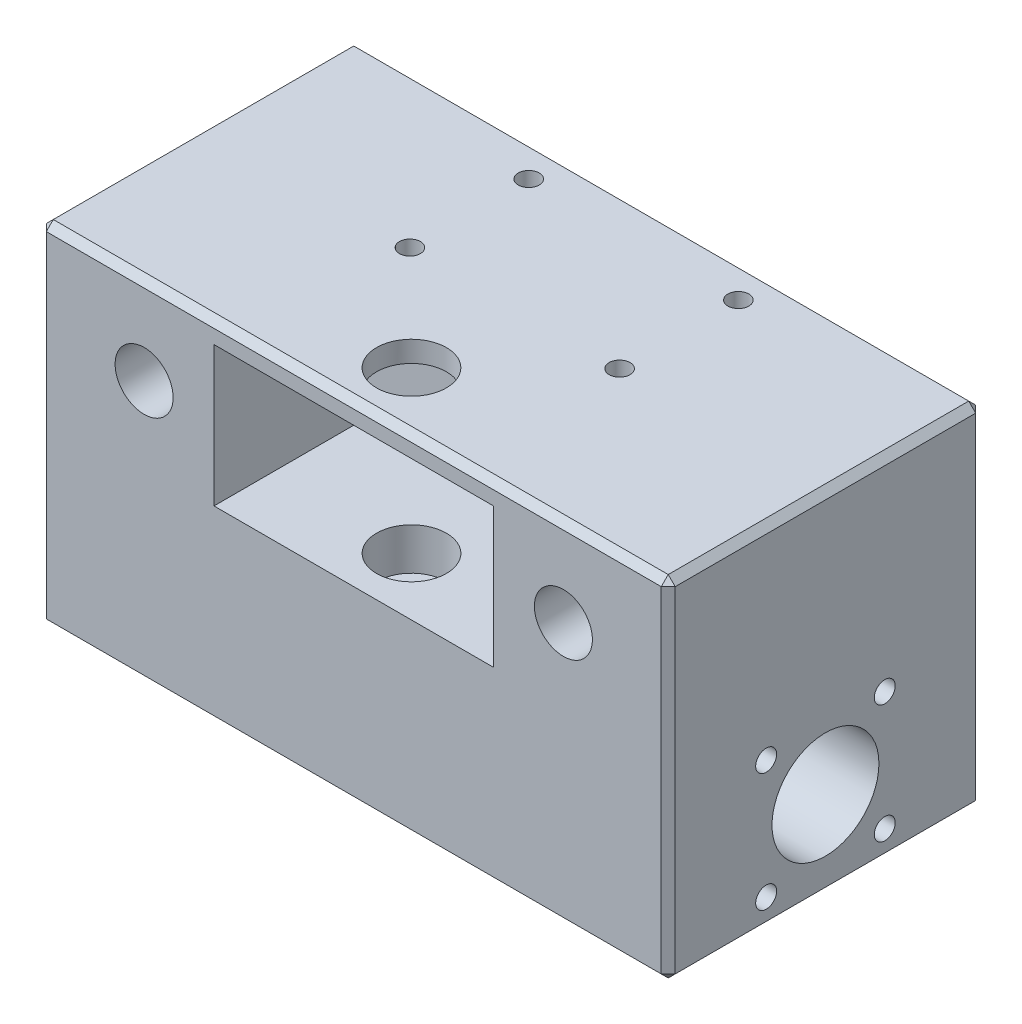
from build123d import *

# Parameters (mm, degrees)
SKETCH1_W           = 90
SKETCH1_H           = 45
BOSS_EXTRUDE1_DEPTH = 50
SKETCH2_R           = 4.15
CUT_EXTRUDE1_DEPTH  = 28.296664924
SKETCH3_R           = 7.65
CUT_EXTRUDE2_DEPTH  = 106.386194542
SKETCH4_R           = 1.5
CUT_EXTRUDE3_DEPTH  = 10
CHAMFER1_SIZE       = 1
SKETCH5_R           = 1.5
CUT_EXTRUDE4_DEPTH  = 10
SKETCH6_W           = 40
SKETCH6_H           = 20
CUT_EXTRUDE5_DEPTH  = 20
SKETCH7_R           = 5
CUT_EXTRUDE6_DEPTH  = 29


with BuildPart() as part:
    # Sketch1 → Boss-Extrude1 (new body)
    with BuildSketch(Plane(origin=(0, 0, 0), x_dir=(1, 0, 0), z_dir=(0, 1, 0))):
        Rectangle(SKETCH1_W, SKETCH1_H)
    extrude(amount=BOSS_EXTRUDE1_DEPTH)

    # Sketch2 → Cut-Extrude1 (cut)
    with BuildSketch(Plane.XY.offset(22.5)):
        with Locations((-30, 37.5)):
            Circle(SKETCH2_R)
        with Locations(Location((30, 37.5, 0), (0, 0, 180))):
            Circle(SKETCH2_R)
    extrude(amount=-CUT_EXTRUDE1_DEPTH, mode=Mode.SUBTRACT)

    # Sketch3 → Cut-Extrude2 (cut, through all)
    with BuildSketch(Plane(origin=(45, 0, 0), x_dir=(0, 0, -1), z_dir=(1, 0, 0))):
        with Locations((0, 12.5)):
            Circle(SKETCH3_R)
    extrude(amount=-CUT_EXTRUDE2_DEPTH, mode=Mode.SUBTRACT)

    # Sketch4 → Cut-Extrude3 (cut)
    with BuildSketch(Plane(origin=(45, 0, 0), x_dir=(0, 0, -1), z_dir=(1, 0, 0))):
        with Locations((-8.485281374, 20.985281374)):
            Circle(SKETCH4_R)
        with Locations((8.485281374, 20.985281374)):
            Circle(SKETCH4_R)
        with Locations((8.485281374, 4.014718626)):
            Circle(SKETCH4_R)
        with Locations((-8.485281374, 4.014718626)):
            Circle(SKETCH4_R)
    cut_extrude3 = extrude(amount=-CUT_EXTRUDE3_DEPTH, mode=Mode.SUBTRACT)

    # Mirror1: Cut-Extrude3 across plane
    add(cut_extrude3.mirror(Plane(origin=(0, 0, 0), x_dir=(0, 0, 1), z_dir=(1, 0, 0))), mode=Mode.SUBTRACT)

    # Chamfer1
    chamfer1_edges = [part.edges().sort_by_distance(p)[0] for p in [
        (-45, 50, 0),
        (0, 50, 22.5),
        (45, 50, 0),
        (0, 0, 22.5),
        (-45, 0, 0),
        (0, 0, -22.5),
        (45, 0, 0),
        (45, 25, 22.5),
        (-45, 25, 22.5),
        (-45, 25, -22.5),
        (45, 25, -22.5),
        (0, 50, -22.5),
    ]]
    chamfer(chamfer1_edges, length=CHAMFER1_SIZE)

    # Sketch5 → Cut-Extrude4 (cut)
    with BuildSketch(Plane(origin=(0, 50, 0), x_dir=(1, 0, 0), z_dir=(0, 1, 0))):
        with Locations(Location((15, 0.53825434, 0), (0, 0, 270))):
            Circle(SKETCH5_R)
        with Locations(Location((15, 17.53825434, 0), (0, 0, 270))):
            Circle(SKETCH5_R)
        with Locations(Location((-15, 17.53825434, 0), (0, 0, 90))):
            Circle(SKETCH5_R)
        with Locations(Location((-15, 0.53825434, 0), (0, 0, 90))):
            Circle(SKETCH5_R)
    extrude(amount=-CUT_EXTRUDE4_DEPTH, mode=Mode.SUBTRACT)

    # Sketch6 → Cut-Extrude5 (cut)
    with BuildSketch(Plane.XY.offset(22.5)):
        with Locations((0, 37)):
            Rectangle(SKETCH6_W, SKETCH6_H)
    extrude(amount=-CUT_EXTRUDE5_DEPTH, mode=Mode.SUBTRACT)

    # Sketch7 → Cut-Extrude6 (cut)
    with BuildSketch(Plane(origin=(0, 50, 0), x_dir=(1, 0, 0), z_dir=(0, 1, 0))):
        with Locations(Location((0, -14.241832216, 0), (0, 0, 90))):
            Circle(SKETCH7_R)
    extrude(amount=-CUT_EXTRUDE6_DEPTH, mode=Mode.SUBTRACT)


solid = part.part
